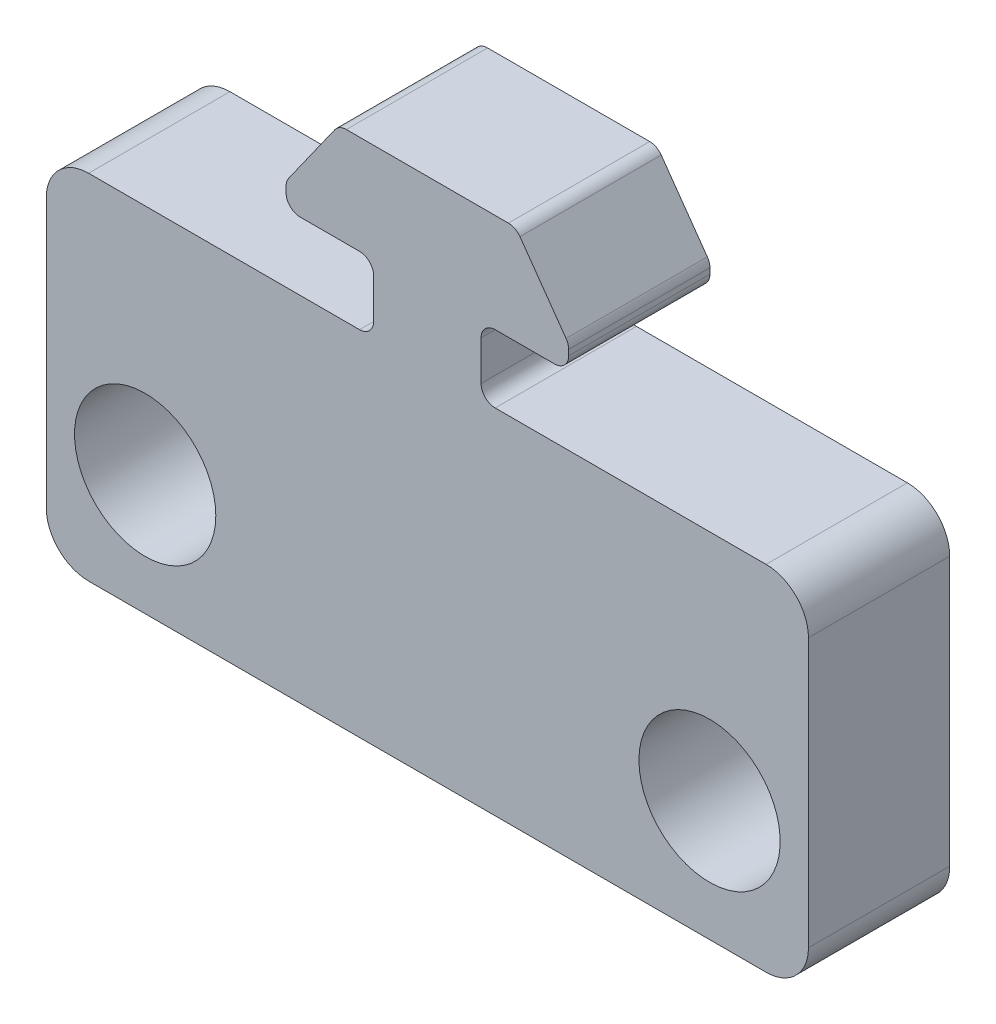
from build123d import *

# Parameters (mm, degrees)
BOSS_EXTRUDE1_DEPTH = 10
BOSS_EXTRUDE2_DEPTH = 10
SKETCH5_R           = 5
CUT_EXTRUDE1_DEPTH  = 42.419846722
FILLET1_R           = 1
FILLET2_R           = 1
FILLET3_R           = 3


with BuildPart() as part:
    # Sketch2 → Boss-Extrude1 (new body)
    with BuildSketch(Plane.XY):
        Polygon((-10, 0), (0, 0), (0, 7), (-6.25480432, 7), (-10, 1.709943763), align=None)
        Polygon((0, 0), (10, 0), (10, 1.709943763), (6.25480432, 7), (0, 7), align=None)
    extrude(amount=BOSS_EXTRUDE1_DEPTH)

    # Sketch4 → Boss-Extrude2 (add)
    with BuildSketch(Plane.XY):
        Polygon((0, 0), (-3.8, 0), (-3.8, -4.8), (-26.973388784, -4.8), (-26.973388784, -29.8), (0, -29.8), align=None)
        Polygon((3.8, 0), (0, 0), (0, -29.8), (26.973388784, -29.8), (26.973388784, -4.8), (3.8, -4.8), align=None)
    extrude(amount=BOSS_EXTRUDE2_DEPTH)

    # Sketch5 → Cut-Extrude1 (cut, through all)
    with BuildSketch(Plane.XY):
        with Locations((-19.973388784, -21.288554557)):
            Circle(SKETCH5_R)
        with Locations(Location((19.973388784, -21.288554557, 0), (0, 0, 180))):
            Circle(SKETCH5_R)
    extrude(amount=CUT_EXTRUDE1_DEPTH, mode=Mode.SUBTRACT)

    # Fillet1
    fillet1_edges = [part.edges().sort_by_distance(p)[0] for p in [
        (-10, 0, 5),
        (-10, 1.709943763, 5),
        (-6.25480432, 7, 5),
        (6.25480432, 7, 5),
        (10, 1.709943763, 5),
        (10, 0, 5),
    ]]
    fillet(fillet1_edges, radius=FILLET1_R)

    # Fillet2
    fillet2_edges = [part.edges().sort_by_distance(p)[0] for p in [
        (3.8, -4.8, 5),
        (3.8, 0, 5),
        (-3.8, 0, 5),
        (-3.8, -4.8, 5),
    ]]
    fillet(fillet2_edges, radius=FILLET2_R)

    # Fillet3
    fillet3_edges = [part.edges().sort_by_distance(p)[0] for p in [
        (-26.973388784, -29.8, 5),
        (26.973388784, -29.8, 5),
        (26.973388784, -4.8, 5),
        (-26.973388784, -4.8, 5),
    ]]
    fillet(fillet3_edges, radius=FILLET3_R)


solid = part.part
